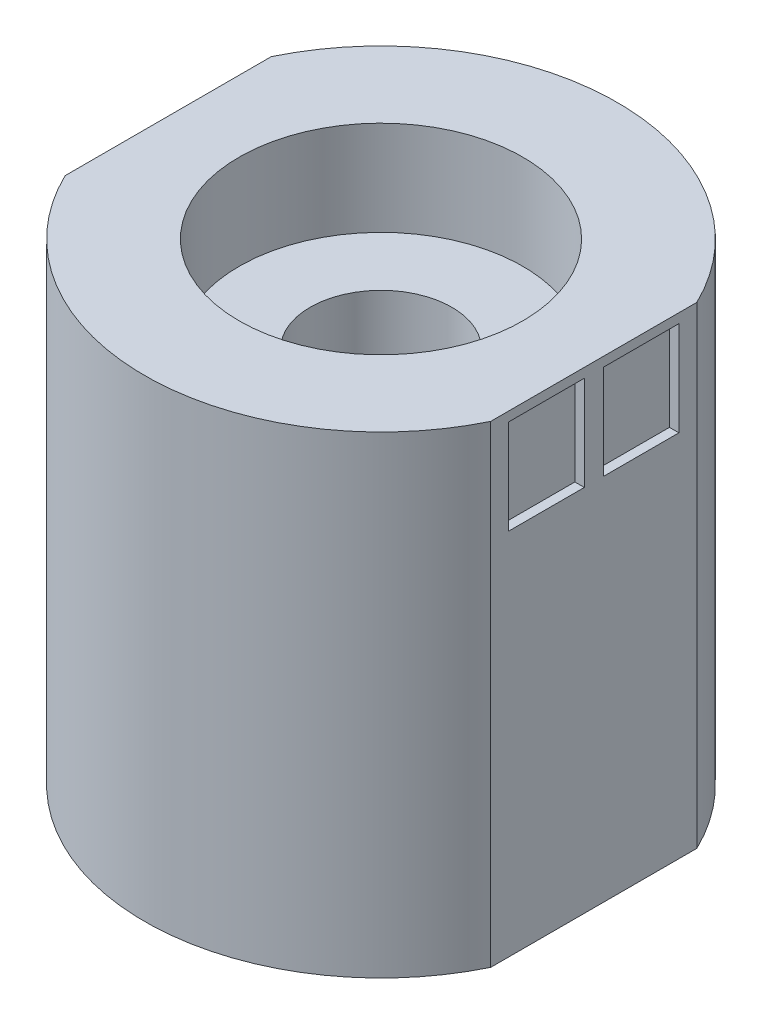
from build123d import *

# Parameters (mm, degrees)
SKETCH_1_R          = 25
SKETCH_1_R_2        = 7.5
EXTRUDE_1_DEPTH     = 50
SKETCH_2_R          = 15
CUT_EXTRUDE_1_DEPTH = 10
SKETCH_3_OUTSIDE_W  = 69.32
SKETCH_3_OUTSIDE_H  = 69.32
CUT_EXTRUDE_2_DEPTH = 62.23724357
SKETCH_4_W          = 8
SKETCH_4_H          = 10
CUT_EXTRUDE_3_DEPTH = 1


with BuildPart() as part:
    # ｽｹｯﾁ1 → ﾎﾞｽ - 押し出し1 (new body)
    with BuildSketch(Plane(origin=(0, 0, 0), x_dir=(1, 0, 0), z_dir=(0, 1, 0))):
        with Locations(Location((0, 0, 0), (0, 0, 270))):
            Circle(SKETCH_1_R)
        with Locations(Location((0, 0, 0), (0, 0, 270))):
            Circle(SKETCH_1_R_2, mode=Mode.SUBTRACT)
    extrude(amount=EXTRUDE_1_DEPTH)

    # ｽｹｯﾁ2 → ｶｯﾄ - 押し出し1 (cut)
    with BuildSketch(Plane(origin=(0, 50, 0), x_dir=(1, 0, 0), z_dir=(0, 1, 0))):
        with Locations(Location((0, 0, 0), (0, 0, 270))):
            Circle(SKETCH_2_R)
    extrude(amount=-CUT_EXTRUDE_1_DEPTH, mode=Mode.SUBTRACT)

    # ｽｹｯﾁ3 outside → ｶｯﾄ - 押し出し2 (cut, through all)
    with BuildSketch(Plane(origin=(0, 50, 0), x_dir=(1, 0, 0), z_dir=(0, 1, 0))):
        Rectangle(SKETCH_3_OUTSIDE_W, SKETCH_3_OUTSIDE_H)
        with BuildLine():
            Line((-22.5, 10.897247359), (-22.5, -10.897247359))
            ThreePointArc((-22.5, -10.897247359), (0, -25), (22.5, -10.897247359))
            Line((22.5, -10.897247359), (22.5, 10.897247359))
            ThreePointArc((22.5, 10.897247359), (0, 25), (-22.5, 10.897247359))
        make_face(mode=Mode.SUBTRACT)
    extrude(amount=-CUT_EXTRUDE_2_DEPTH, mode=Mode.SUBTRACT)

    # ｽｹｯﾁ4 → ｶｯﾄ - 押し出し3 (cut)
    with BuildSketch(Plane.ZY.offset(22.5)):
        with Locations((-5, 44)):
            Rectangle(SKETCH_4_W, SKETCH_4_H)
        with Locations((5, 44)):
            Rectangle(SKETCH_4_W, SKETCH_4_H)
    cut_extrude_3 = extrude(amount=-CUT_EXTRUDE_3_DEPTH, mode=Mode.SUBTRACT)

    # ﾐﾗｰ1: ｶｯﾄ - 押し出し3 across plane
    add(cut_extrude_3.mirror(Plane(origin=(0, 0, 0), x_dir=(0, 0, 1), z_dir=(1, 0, 0))), mode=Mode.SUBTRACT)


solid = part.part
